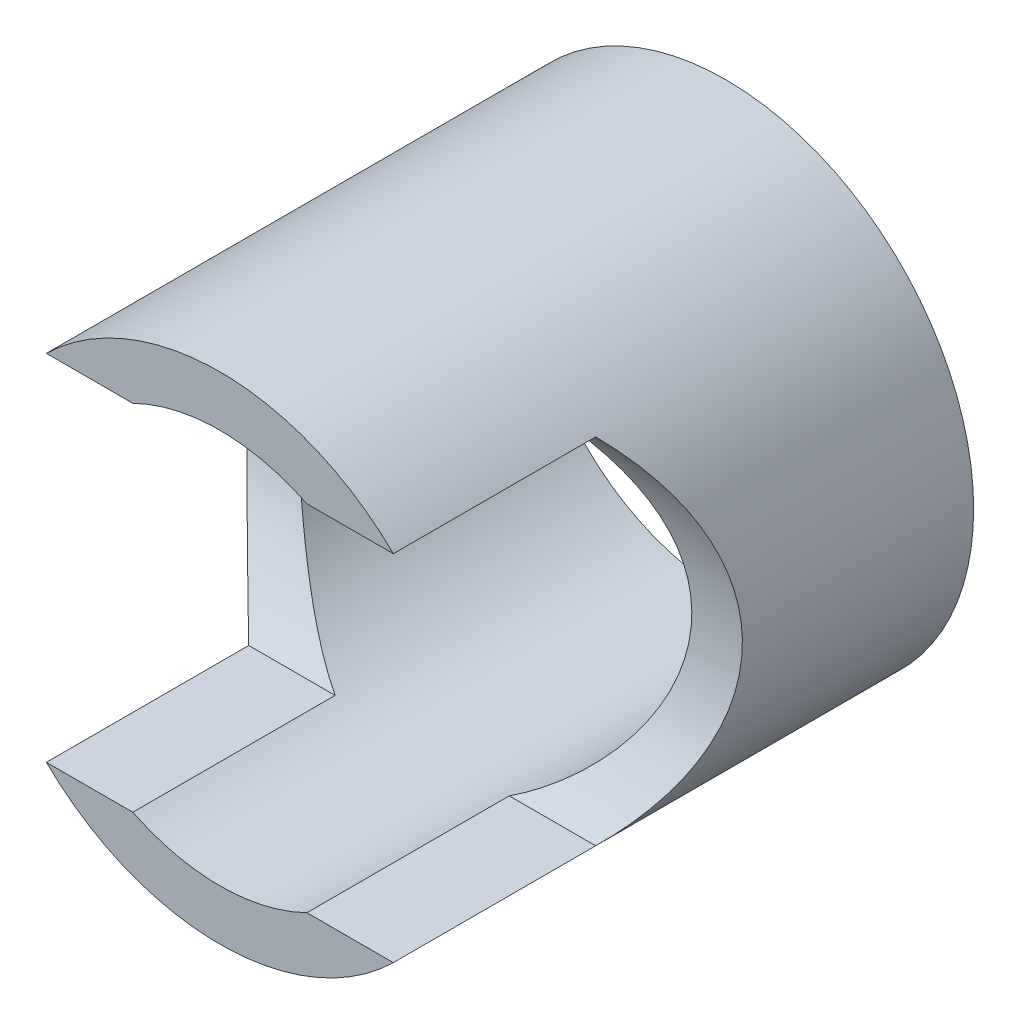
from build123d import *

# Parameters (mm, degrees)
SKETCH1_R           = 4.9
SKETCH1_R_2         = 3.9
BOSS_EXTRUDE1_DEPTH = 10
CUT_EXTRUDE1_DEPTH  = 10


with BuildPart() as part:
    # Sketch1 → Boss-Extrude1 (new body)
    with BuildSketch(Plane.XY):
        Circle(SKETCH1_R)
        Circle(SKETCH1_R_2, mode=Mode.SUBTRACT)
    extrude(amount=BOSS_EXTRUDE1_DEPTH)

    # Sketch3 → Cut-Extrude1 (cut)
    with BuildSketch(Plane(origin=(4.9, 0, 0), x_dir=(0, 0, -1), z_dir=(1, 0, 0))):
        with BuildLine():
            Line((-10, 3.5), (-10, -3.5))
            Line((-10, -3.5), (-6, -3.5))
            ThreePointArc((-6, -3.5), (-4.570714214, 0), (-6, 3.5))
            Line((-6, 3.5), (-10, 3.5))
        make_face()
    extrude(amount=-CUT_EXTRUDE1_DEPTH, mode=Mode.SUBTRACT)


solid = part.part
